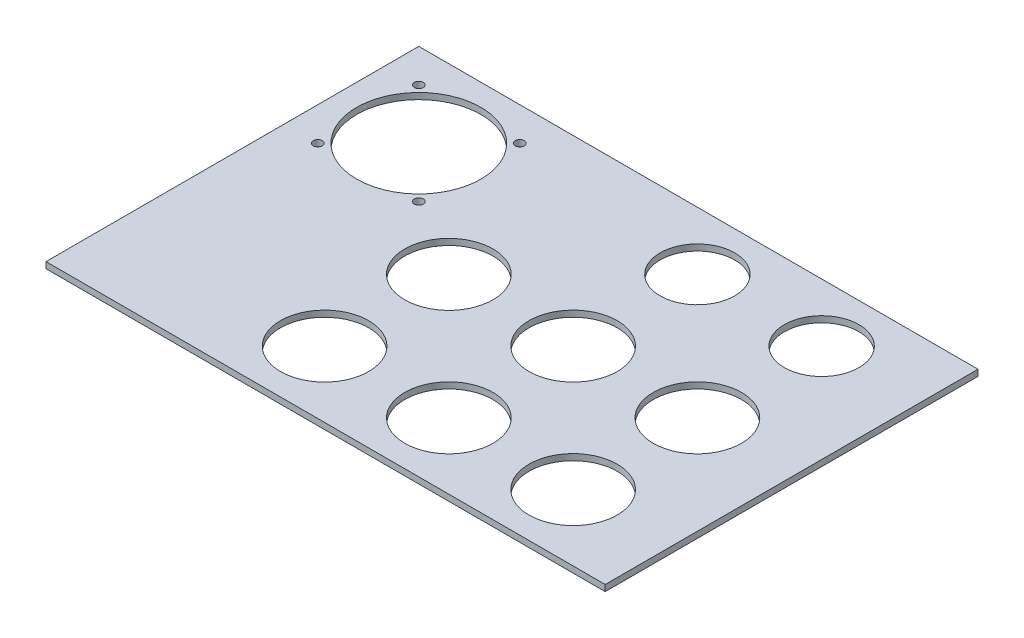
from build123d import *

# Parameters (mm, degrees)
SKETCH1_W              = 180
SKETCH1_H              = 120
BOSS_EXTRUDE1_DEPTH    = 2
BUTTON_HOLES_CUT_REACH = 144.444
SKETCH2_R              = 14.2
SKETCH2_R_2            = 12
SKETCH2_R_3            = 20.01
M2_5_CLEARANCE_HOLE1_D = 2.9


with BuildPart() as part:
    # Sketch1 → Boss-Extrude1 (new body)
    with BuildSketch(Plane(origin=(0, 0, 0), x_dir=(1, 0, 0), z_dir=(0, 1, 0))):
        with Locations((-28.728476821, 18.675496689)):
            Rectangle(SKETCH1_W, SKETCH1_H)
    extrude(amount=BOSS_EXTRUDE1_DEPTH)

    # Sketch2 → button_holes_cut (cut, up to next)
    with BuildSketch(Plane(origin=(0, 2, 0), x_dir=(1, 0, 0), z_dir=(0, 1, 0)), mode=Mode.PRIVATE) as button_holes_cut_sk1:
        with Locations(Location((-50.338026535, -20.041382951, 0), (0, 0, 270))):
            Circle(SKETCH2_R)
    button_holes_cut_tool1 = extrude(button_holes_cut_sk1.sketch, amount=-BUTTON_HOLES_CUT_REACH, mode=Mode.PRIVATE) & part.part
    # Sketch2 → button_holes_cut (cut, up to next)
    with BuildSketch(Plane(origin=(0, 2, 0), x_dir=(1, 0, 0), z_dir=(0, 1, 0)), mode=Mode.PRIVATE) as button_holes_cut_sk2:
        with Locations(Location((29.661973465, 59.958617049, 0), (0, 0, 270))):
            Circle(SKETCH2_R_2)
    button_holes_cut_tool2 = extrude(button_holes_cut_sk2.sketch, amount=-BUTTON_HOLES_CUT_REACH, mode=Mode.PRIVATE) & part.part
    # Sketch2 → button_holes_cut (cut, up to next)
    with BuildSketch(Plane(origin=(0, 2, 0), x_dir=(1, 0, 0), z_dir=(0, 1, 0)), mode=Mode.PRIVATE) as button_holes_cut_sk3:
        with Locations(Location((-10.338026535, 59.958617049, 0), (0, 0, 270))):
            Circle(SKETCH2_R_2)
    button_holes_cut_tool3 = extrude(button_holes_cut_sk3.sketch, amount=-BUTTON_HOLES_CUT_REACH, mode=Mode.PRIVATE) & part.part
    # Sketch2 → button_holes_cut (cut, up to next)
    with BuildSketch(Plane(origin=(0, 2, 0), x_dir=(1, 0, 0), z_dir=(0, 1, 0)), mode=Mode.PRIVATE) as button_holes_cut_sk4:
        with Locations(Location((-10.338026535, -20.041382951, 0), (0, 0, 270))):
            Circle(SKETCH2_R)
    button_holes_cut_tool4 = extrude(button_holes_cut_sk4.sketch, amount=-BUTTON_HOLES_CUT_REACH, mode=Mode.PRIVATE) & part.part
    # Sketch2 → button_holes_cut (cut, up to next)
    with BuildSketch(Plane(origin=(0, 2, 0), x_dir=(1, 0, 0), z_dir=(0, 1, 0)), mode=Mode.PRIVATE) as button_holes_cut_sk5:
        with Locations(Location((29.661973465, -20.041382951, 0), (0, 0, 270))):
            Circle(SKETCH2_R)
    button_holes_cut_tool5 = extrude(button_holes_cut_sk5.sketch, amount=-BUTTON_HOLES_CUT_REACH, mode=Mode.PRIVATE) & part.part
    # Sketch2 → button_holes_cut (cut, up to next)
    with BuildSketch(Plane(origin=(0, 2, 0), x_dir=(1, 0, 0), z_dir=(0, 1, 0)), mode=Mode.PRIVATE) as button_holes_cut_sk6:
        with Locations(Location((-50.338026535, 19.958617049, 0), (0, 0, 270))):
            Circle(SKETCH2_R)
    button_holes_cut_tool6 = extrude(button_holes_cut_sk6.sketch, amount=-BUTTON_HOLES_CUT_REACH, mode=Mode.PRIVATE) & part.part
    # Sketch2 → button_holes_cut (cut, up to next)
    with BuildSketch(Plane(origin=(0, 2, 0), x_dir=(1, 0, 0), z_dir=(0, 1, 0)), mode=Mode.PRIVATE) as button_holes_cut_sk7:
        with Locations(Location((-10.338026535, 19.958617049, 0), (0, 0, 270))):
            Circle(SKETCH2_R)
    button_holes_cut_tool7 = extrude(button_holes_cut_sk7.sketch, amount=-BUTTON_HOLES_CUT_REACH, mode=Mode.PRIVATE) & part.part
    # Sketch2 → button_holes_cut (cut, up to next)
    with BuildSketch(Plane(origin=(0, 2, 0), x_dir=(1, 0, 0), z_dir=(0, 1, 0)), mode=Mode.PRIVATE) as button_holes_cut_sk8:
        with Locations(Location((29.661973465, 19.958617049, 0), (0, 0, 270))):
            Circle(SKETCH2_R)
    button_holes_cut_tool8 = extrude(button_holes_cut_sk8.sketch, amount=-BUTTON_HOLES_CUT_REACH, mode=Mode.PRIVATE) & part.part
    # Sketch2 → button_holes_cut (cut, up to next)
    with BuildSketch(Plane(origin=(0, 2, 0), x_dir=(1, 0, 0), z_dir=(0, 1, 0)), mode=Mode.PRIVATE) as button_holes_cut_sk9:
        with Locations(Location((-91.728476821, 51.675496689, 0), (0, 0, 270))):
            Circle(SKETCH2_R_3)
    button_holes_cut_tool9 = extrude(button_holes_cut_sk9.sketch, amount=-BUTTON_HOLES_CUT_REACH, mode=Mode.PRIVATE) & part.part
    add(button_holes_cut_tool1.solids().sort_by_distance((-50.338027, 2, 20.041383))[0], mode=Mode.SUBTRACT)
    add(button_holes_cut_tool2.solids().sort_by_distance((29.661973, 2, -59.958617))[0], mode=Mode.SUBTRACT)
    add(button_holes_cut_tool3.solids().sort_by_distance((-10.338027, 2, -59.958617))[0], mode=Mode.SUBTRACT)
    add(button_holes_cut_tool4.solids().sort_by_distance((-10.338027, 2, 20.041383))[0], mode=Mode.SUBTRACT)
    add(button_holes_cut_tool5.solids().sort_by_distance((29.661973, 2, 20.041383))[0], mode=Mode.SUBTRACT)
    add(button_holes_cut_tool6.solids().sort_by_distance((-50.338027, 2, -19.958617))[0], mode=Mode.SUBTRACT)
    add(button_holes_cut_tool7.solids().sort_by_distance((-10.338027, 2, -19.958617))[0], mode=Mode.SUBTRACT)
    add(button_holes_cut_tool8.solids().sort_by_distance((29.661973, 2, -19.958617))[0], mode=Mode.SUBTRACT)
    add(button_holes_cut_tool9.solids().sort_by_distance((-91.728477, 2, -51.675497))[0], mode=Mode.SUBTRACT)

    # M2.5 Clearance Hole1 (through all)
    with Locations(Plane(origin=(0, 2, 0), x_dir=(1, 0, 0), z_dir=(0, 1, 0))):
        with Locations((-91.728476821, 51.675496689), (-75.478476821, 67.925496689), (-107.978476821, 67.925496689), (-75.478476821, 35.425496689), (-107.978476821, 35.425496689)):
            Hole(M2_5_CLEARANCE_HOLE1_D / 2)


solid = part.part
